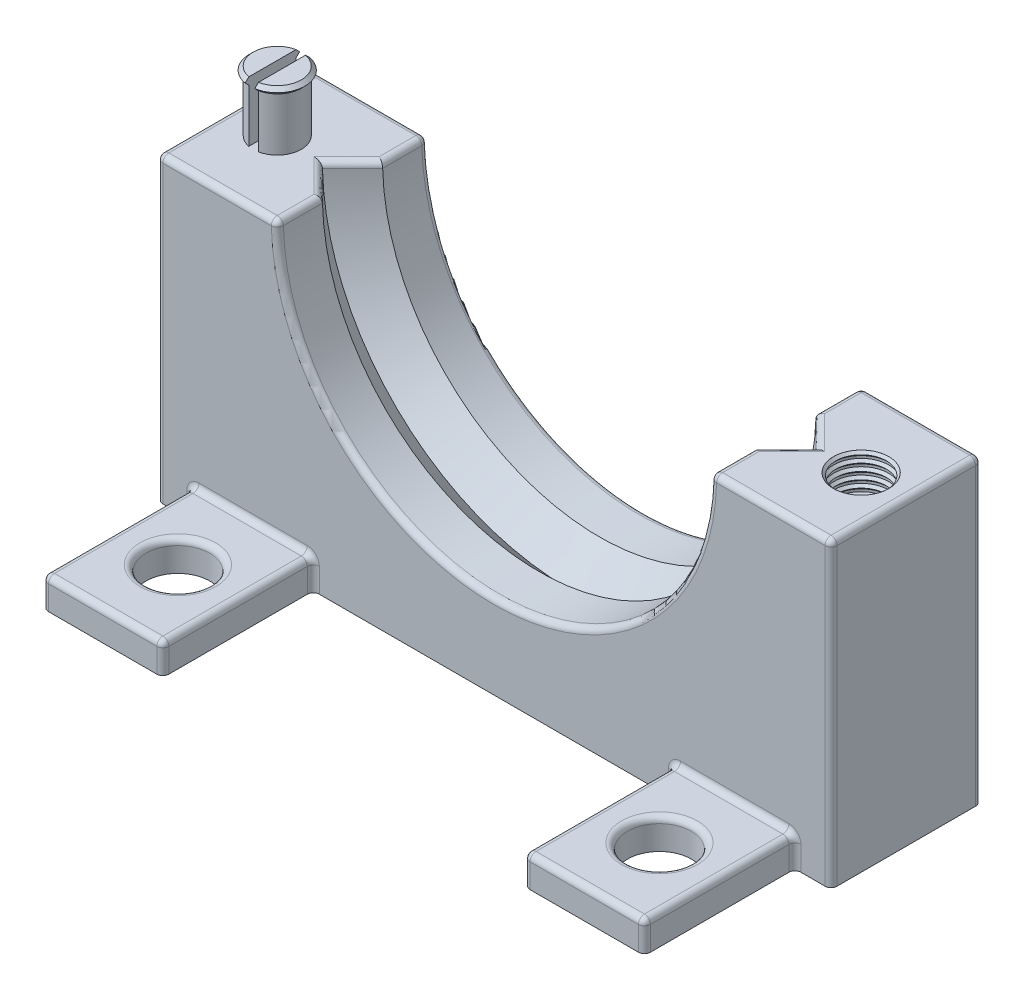
from build123d import *

# Parameters (mm, degrees)
BOSS_EXTRUDE1_DEPTH = 15.875
SKETCH6_R           = 2.921
CUT_EXTRUDE2_DEPTH  = 9.525
CUT_EXTRUDE3_REACH  = 56.481
SKETCH16_W          = 1.016
SKETCH16_H          = 11.1836739
SKETCH17_W          = 12.7
SKETCH17_H          = 15.875
BOSS_EXTRUDE2_DEPTH = 3.175
SKETCH18_R          = 3.3655
CUT_EXTRUDE4_DEPTH  = 3.175
FILLET1_R           = 0.635


with BuildPart() as part:
    # Sketch1 → Boss-Extrude1 (new body)
    with BuildSketch(Plane.XY):
        with BuildLine():
            Line((-35.56, 0), (35.56, 0))
            Line((35.56, 0), (35.56, 31.75))
            Line((35.56, 31.75), (22.86, 31.75))
            ThreePointArc((22.86, 31.75), (0, 8.89), (-22.86, 31.75))
            Line((-22.86, 31.75), (-35.56, 31.75))
            Line((-35.56, 31.75), (-35.56, 0))
        make_face()
    extrude(amount=BOSS_EXTRUDE1_DEPTH)

    # Sketch2 → Cut-Revolve1 (revolve, cut)
    with BuildSketch(Plane(origin=(0, 31.75, 0), x_dir=(1, 0, 0), z_dir=(0, 1, 0))):
        Polygon((22.86, -11.1125), (26.035, -7.9375), (22.86, -4.7625), align=None)
    revolve(axis=Axis((0, 31.75, 0), (0, 0, 1)), mode=Mode.SUBTRACT)

    # Sketch6 → Cut-Extrude2 (cut)
    with BuildSketch(Plane(origin=(0, 31.75, 0), x_dir=(1, 0, 0), z_dir=(0, 1, 0))):
        with Locations(Location((30.7975, -7.9375, 0), (0, 0, 180))):
            Circle(SKETCH6_R)
    extrude(amount=-CUT_EXTRUDE2_DEPTH, mode=Mode.SUBTRACT)

    # Sketch15 → Revolve2 (revolve)
    with BuildSketch(Plane.XY.offset(7.9375), mode=Mode.PRIVATE) as revolve2_sk:
        Polygon((-33.3375, 31.75), (-33.3375, 37.338), (-33.7185, 37.719), (-33.3375, 38.1), (-30.7975, 38.1), (-30.7975, 31.75), align=None)
    revolve(revolve2_sk.sketch.rotate(Axis((-30.7975, 38.1, 7.9375), (0, -1, 0)), 270), axis=Axis((-30.7975, 38.1, 7.9375), (0, -1, 0)))

    # Cut-Extrude3: up to this face of the body (flat: up to its plane)
    cut_extrude3_end = Plane(part.part.faces().sort_by_distance((-29.21, 31.75, 0.203299195))[0])
    # Sketch16 → Cut-Extrude3 (cut, up to the picked face)
    with BuildSketch(Plane(origin=(0, 38.1, 0), x_dir=(1, 0, 0), z_dir=(0, 1, 0)), mode=Mode.PRIVATE) as cut_extrude3_sk1:
        with Locations((-30.7975, -7.9375)):
            Rectangle(SKETCH16_W, SKETCH16_H)
    cut_extrude3_tool1 = split(extrude(cut_extrude3_sk1.sketch, amount=-CUT_EXTRUDE3_REACH, mode=Mode.PRIVATE), bisect_by=cut_extrude3_end, keep=Keep.BOTH, mode=Mode.PRIVATE)
    add(cut_extrude3_tool1.solids().sort_by(Axis((-30.7975, 38.1, 7.9375), (0, -1, 0)))[0], mode=Mode.SUBTRACT)

    # Sketch17 → Boss-Extrude2 (add)
    with BuildSketch(Plane(origin=(0, 0, 0), x_dir=(-1, 0, 0), z_dir=(0, -1, 0))):
        with Locations((25.4, -23.8125)):
            Rectangle(SKETCH17_W, SKETCH17_H)
        with Locations((-25.4, -23.8125)):
            Rectangle(SKETCH17_W, SKETCH17_H)
    extrude(amount=-BOSS_EXTRUDE2_DEPTH)

    # Sketch18 → Cut-Extrude4 (cut)
    with BuildSketch(Plane(origin=(0, 3.175, 0), x_dir=(1, 0, 0), z_dir=(0, 1, 0))):
        with Locations(Location((-25.4, -23.8125, 0), (0, 0, 270))):
            Circle(SKETCH18_R)
        with Locations(Location((25.4, -23.8125, 0), (0, 0, 90))):
            Circle(SKETCH18_R)
    extrude(amount=-CUT_EXTRUDE4_DEPTH, mode=Mode.SUBTRACT)

    # Fillet1
    fillet1_edges = [part.edges().sort_by_distance(p)[0] for p in [
        (19.05, 1.5875, 15.875),
        (31.75, 1.5875, 15.875),
        (25.4, 3.175, 31.75),
        (19.05, 3.175, 23.8125),
        (25.4, 3.175, 15.875),
        (31.75, 3.175, 23.8125),
        (-25.4, 3.175, 20.447),
        (-31.75, 1.5875, 31.75),
        (-19.05, 1.5875, 31.75),
        (19.05, 1.5875, 31.75),
        (31.75, 1.5875, 31.75),
        (0, 8.89, 15.875),
        (0, 8.89, 0),
        (35.56, 15.875, 0),
        (35.56, 15.875, 15.875),
        (-35.56, 15.875, 15.875),
        (-35.56, 15.875, 0),
        (-31.75, 1.5875, 15.875),
        (-19.05, 1.5875, 15.875),
        (-25.4, 3.175, 15.875),
        (-19.05, 3.175, 23.8125),
        (-25.4, 3.175, 31.75),
        (-31.75, 3.175, 23.8125),
        (-24.4475, 31.75, 9.525),
        (-24.4475, 31.75, 6.35),
        (24.4475, 31.75, 9.525),
        (24.4475, 31.75, 6.35),
        (22.86, 31.75, 13.49375),
        (22.86, 31.75, 2.38125),
        (29.21, 31.75, 0),
        (35.56, 31.75, 7.9375),
        (29.21, 31.75, 15.875),
        (-22.86, 31.75, 13.49375),
        (-22.86, 31.75, 2.38125),
        (-29.21, 31.75, 0),
        (-35.56, 31.75, 7.9375),
        (-29.21, 31.75, 15.875),
        (25.4, 3.175, 27.178),
    ]]
    fillet(fillet1_edges, radius=FILLET1_R)


with BuildPart() as body_2:
    # Sketch12 → Revolve1 (revolve)
    with BuildSketch(Plane.XY.offset(7.9375), mode=Mode.PRIVATE) as revolve1_sk:
        Polygon((27.8765, 30.48), (28.1305, 30.734), (27.8765, 30.988), align=None)
        Polygon((27.8765, 31.242), (28.1305, 31.496), (27.8765, 31.75), align=None)
        Polygon((27.8765, 29.718), (28.1305, 29.972), (27.8765, 30.226), align=None)
        Polygon((27.8765, 28.956), (28.1305, 29.21), (27.8765, 29.464), align=None)
        Polygon((27.8765, 28.194), (28.1305, 28.448), (27.8765, 28.702), align=None)
        Polygon((27.8765, 27.432), (28.1305, 27.686), (27.8765, 27.94), align=None)
        Polygon((27.8765, 26.67), (28.1305, 26.924), (27.8765, 27.178), align=None)
        Polygon((27.8765, 25.908), (28.1305, 26.162), (27.8765, 26.416), align=None)
        Polygon((27.8765, 25.146), (28.1305, 25.4), (27.8765, 25.654), align=None)
        Polygon((27.8765, 24.384), (28.1305, 24.638), (27.8765, 24.892), align=None)
        Polygon((27.8765, 23.622), (28.1305, 23.876), (27.8765, 24.13), align=None)
        Polygon((27.8765, 22.86), (28.1305, 23.114), (27.8765, 23.368), align=None)
        Polygon((27.8765, 22.098), (28.1305, 22.352), (27.8765, 22.606), align=None)
        Polygon((27.8765, 21.336), (28.1305, 21.59), (27.8765, 21.844), align=None)
        Polygon((27.8765, 20.574), (28.1305, 20.828), (27.8765, 21.082), align=None)
        Polygon((27.8765, 19.812), (28.1305, 20.066), (27.8765, 20.32), align=None)
        Polygon((27.8765, 19.05), (28.1305, 19.304), (27.8765, 19.558), align=None)
        Polygon((27.8765, 18.288), (28.1305, 18.542), (27.8765, 18.796), align=None)
        Polygon((27.8765, 17.526), (28.1305, 17.78), (27.8765, 18.034), align=None)
        Polygon((27.8765, 16.764), (28.1305, 17.018), (27.8765, 17.272), align=None)
    revolve(revolve1_sk.sketch.rotate(Axis((30.7975, 31.75, 7.9375), (0, -1, 0)), 270), axis=Axis((30.7975, 31.75, 7.9375), (0, -1, 0)))


solid = Compound([part.part, body_2.part])
